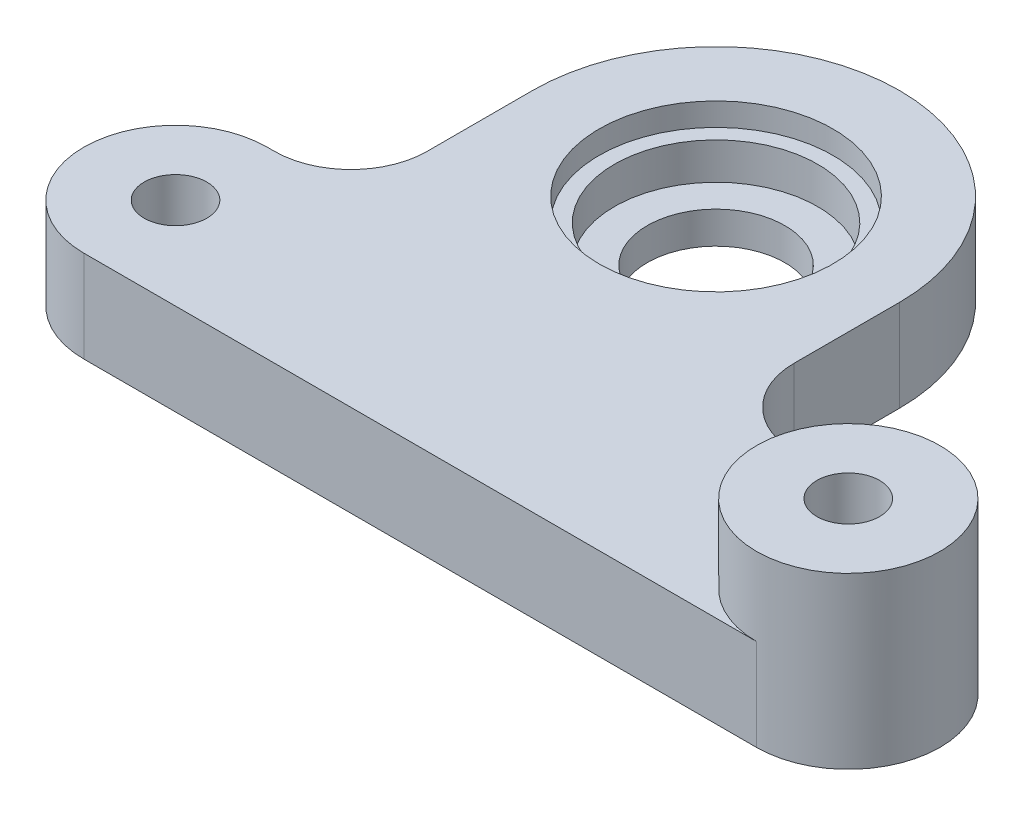
from build123d import *

# Parameters (mm, degrees)
SKETCH_1_R          = 4.5
SKETCH_1_R_2        = 2.05
EXTRUDE_1_DEPTH     = 6
SKETCH_2_R          = 4
CUT_EXTRUDE_1_DEPTH = 2
SKETCH_3_R          = 6.65
CUT_EXTRUDE_2_DEPTH = 3.9
SKETCH_4_R          = 7.65
CUT_EXTRUDE_3_DEPTH = 1.5
SKETCH_5_R          = 6
SKETCH_5_R_2        = 2.05
EXTRUDE_2_DEPTH     = 5.1


with BuildPart() as part:
    # 草图1 → 凸台-拉伸1 (new body)
    with BuildSketch(Plane(origin=(0, 0, 0), x_dir=(1, 0, 0), z_dir=(0, 1, 0))):
        with BuildLine():
            Line((-14.168368772, -10.096516067), (29.831631228, -10.096516067))
            ThreePointArc((29.831631228, -10.096516067), (35.831631228, -4.096516067), (29.831631228, 1.903483933))
            Line((29.831631228, 1.903483933), (20.297540319, 1.903483933))
            ThreePointArc((20.297540319, 1.903483933), (16.762006413, 3.367950028), (15.297540319, 6.903483933))
            Line((15.297540319, 6.903483933), (15.297540319, 13.790407079))
            ThreePointArc((15.297540319, 13.790407079), (3.297540319, 25.790407079), (-8.702459681, 13.790407079))
            Line((-8.702459681, 13.790407079), (-8.702459681, 6.903483933))
            ThreePointArc((-8.702459681, 6.903483933), (-10.166925775, 3.367950028), (-13.702459681, 1.903483933))
            Line((-13.702459681, 1.903483933), (-14.168368772, 1.903483933))
            ThreePointArc((-14.168368772, 1.903483933), (-20.168368772, -4.096516067), (-14.168368772, -10.096516067))
        make_face()
        with Locations(Location((3.297540319, 13.790407079, 0), (0, 0, 270))):
            Circle(SKETCH_1_R, mode=Mode.SUBTRACT)
        with Locations(Location((-14.168368772, -4.096516067, 0), (0, 0, 270))):
            Circle(SKETCH_1_R_2, mode=Mode.SUBTRACT)
        with Locations(Location((29.831631228, -4.096516067, 0), (0, 0, 270))):
            Circle(SKETCH_1_R_2, mode=Mode.SUBTRACT)
    extrude(amount=EXTRUDE_1_DEPTH)

    # 草图2 → 切除-拉伸1 (cut)
    with BuildSketch(Plane.XZ):
        with Locations(Location((-14.168368772, 4.096516067, 0), (0, 0, 270))):
            Circle(SKETCH_2_R)
        with Locations(Location((29.831631228, 4.096516067, 0), (0, 0, 270))):
            Circle(SKETCH_2_R)
    extrude(amount=-CUT_EXTRUDE_1_DEPTH, mode=Mode.SUBTRACT)

    # 草图3 → 切除-拉伸2 (cut)
    with BuildSketch(Plane(origin=(0, 6, 0), x_dir=(1, 0, 0), z_dir=(0, 1, 0))):
        with Locations(Location((3.297540319, 13.790407079, 0), (0, 0, 270))):
            Circle(SKETCH_3_R)
    extrude(amount=-CUT_EXTRUDE_2_DEPTH, mode=Mode.SUBTRACT)

    # 草图4 → 切除-拉伸3 (cut)
    with BuildSketch(Plane(origin=(0, 6, 0), x_dir=(1, 0, 0), z_dir=(0, 1, 0))):
        with Locations(Location((3.297540319, 13.790407079, 0), (0, 0, 270))):
            Circle(SKETCH_4_R)
    extrude(amount=-CUT_EXTRUDE_3_DEPTH, mode=Mode.SUBTRACT)

    # 草图5 → 凸台-拉伸2 (add)
    with BuildSketch(Plane(origin=(0, 6, 0), x_dir=(1, 0, 0), z_dir=(0, 1, 0))):
        with Locations(Location((29.831631228, -4.096516067, 0), (0, 0, 270))):
            Circle(SKETCH_5_R)
        with Locations(Location((29.831631228, -4.096516067, 0), (0, 0, 90))):
            Circle(SKETCH_5_R_2, mode=Mode.SUBTRACT)
    extrude(amount=EXTRUDE_2_DEPTH)


solid = part.part
